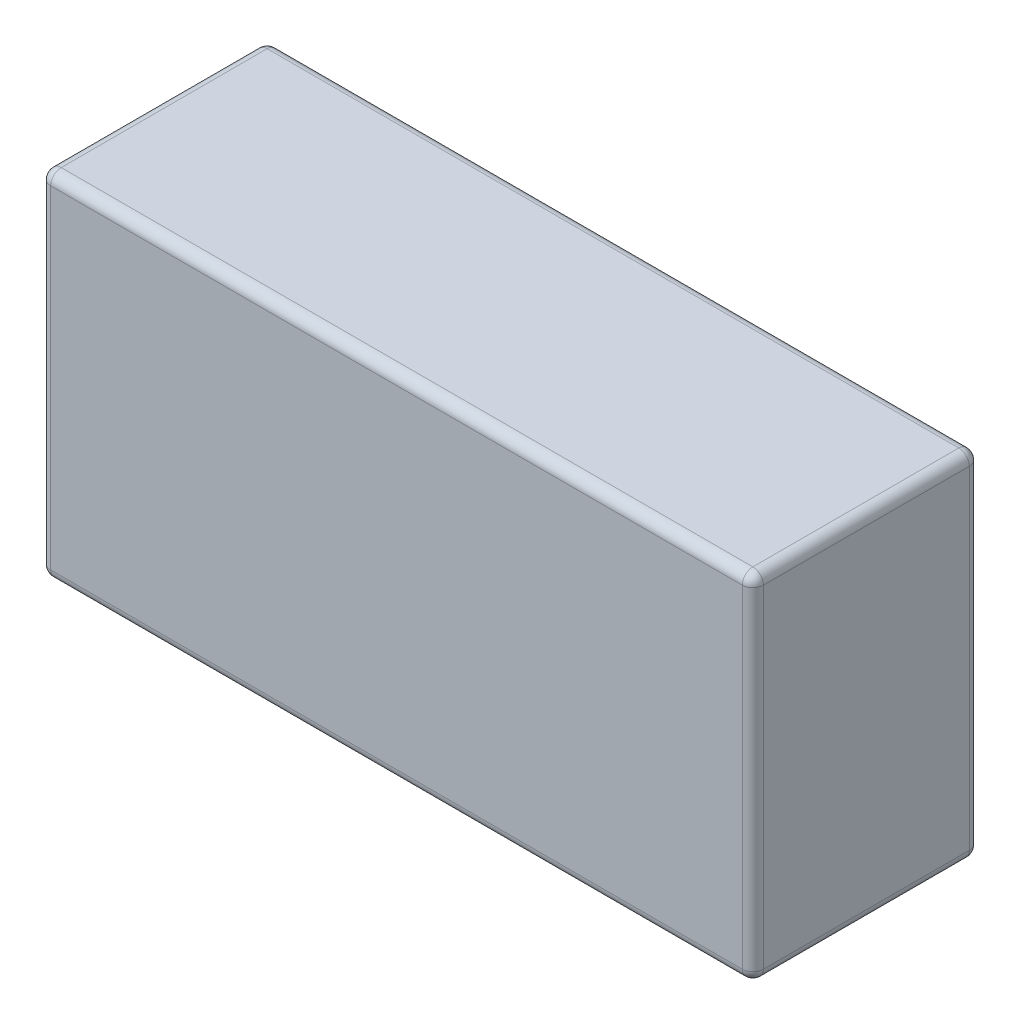
from build123d import *

# Parameters (mm, degrees)
SKETCH_1_W      = 135
SKETCH_1_H      = 43
EXTRUDE_1_DEPTH = 67
FILLET_1_R      = 2


with BuildPart() as part:
    # Эскиз1 → Бобышка-Вытянуть1 (new body)
    with BuildSketch(Plane(origin=(0, 0, 0), x_dir=(1, 0, 0), z_dir=(0, 1, 0))):
        with Locations((-67.5, 21.5)):
            Rectangle(SKETCH_1_W, SKETCH_1_H)
    extrude(amount=EXTRUDE_1_DEPTH)

    # Скругление1
    fillet_1_edges = [part.edges().sort_by_distance(p)[0] for p in [
        (-135, 67, -21.5),
        (-67.5, 67, 0),
        (0, 67, -21.5),
        (-67.5, 0, 0),
        (-135, 0, -21.5),
        (-67.5, 0, -43),
        (0, 0, -21.5),
        (0, 33.5, 0),
        (-135, 33.5, 0),
        (-135, 33.5, -43),
        (0, 33.5, -43),
        (-67.5, 67, -43),
    ]]
    fillet(fillet_1_edges, radius=FILLET_1_R)


solid = part.part
